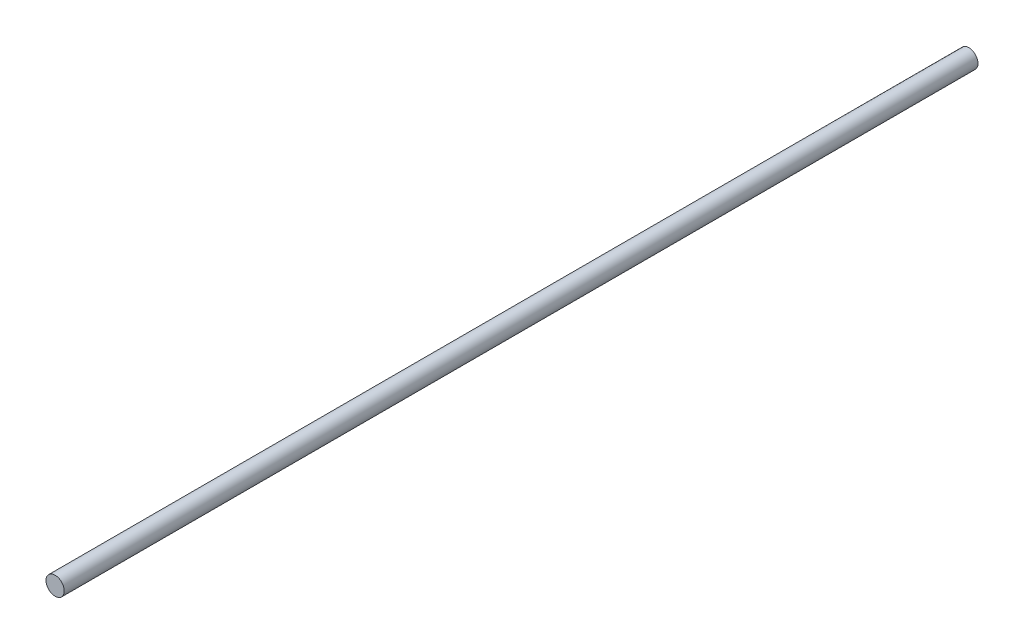
from build123d import *

# Parameters (mm, degrees)
ESBO_O1_R                = 2.5
RESSALTO_EXTRUS_O1_DEPTH = 250


with BuildPart() as part:
    # Esboço1 → Ressalto-extrusão1 (new body)
    with BuildSketch(Plane.XY):
        Circle(ESBO_O1_R)
    extrude(amount=RESSALTO_EXTRUS_O1_DEPTH)


solid = part.part
